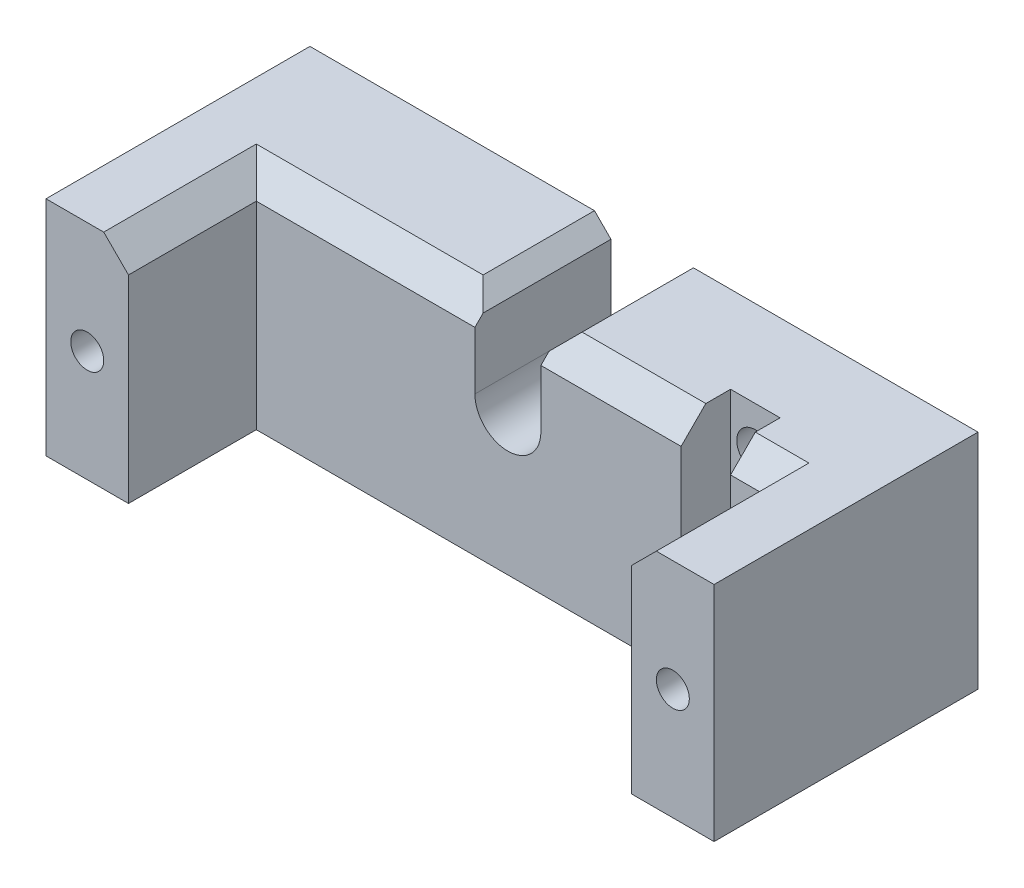
from build123d import *

# Parameters (mm, degrees)
ESQUISSE5_W             = 61
ESQUISSE5_H             = 27
BOSS_EXTRU_2_DEPTH      = 16.5
ENL_V_MAT_EXTRU_2_DEPTH = 16.5
ESQUISSE7_W             = 10
ESQUISSE7_H             = 27
BOSS_EXTRU_3_DEPTH      = 32
ESQUISSE8_R             = 2
ENL_V_MAT_EXTRU_3_DEPTH = 40
ESQUISSE9_R             = 3.75
ENL_V_MAT_EXTRU_4_DEPTH = 4
CHANFREIN1_SIZE         = 2
CHANFREIN2_SIZE         = 3
ESQUISSE10_W            = 6
ESQUISSE10_H            = 6
ENL_V_MAT_EXTRU_5_DEPTH = 36
ESQUISSE11_R            = 2.25
ENL_V_MAT_EXTRU_6_DEPTH = 8
ESQUISSE12_R            = 1.5
ENL_V_MAT_EXTRU_7_DEPTH = 8
CHANFREIN3_SIZE         = 3


with BuildPart() as part:
    # Esquisse5 → Boss.-Extru.2 (new body)
    with BuildSketch(Plane.XY):
        Rectangle(ESQUISSE5_W, ESQUISSE5_H)
    extrude(amount=BOSS_EXTRU_2_DEPTH)

    # Esquisse6 → Enlèv. mat.-Extru.2 (cut)
    with BuildSketch(Plane.XY.offset(16.5)):
        with BuildLine():
            Line((-4, 38.524390244), (4, 38.524390244))
            Line((4, 38.524390244), (4, 3.5))
            ThreePointArc((4, 3.5), (0, -0.5), (-4, 3.5))
            Line((-4, 3.5), (-4, 38.524390244))
        make_face()
    extrude(amount=-ENL_V_MAT_EXTRU_2_DEPTH, mode=Mode.SUBTRACT)

    # Esquisse7 → Boss.-Extru.3 (add)
    with BuildSketch(Plane(origin=(0, 0, 0), x_dir=(-1, 0, 0), z_dir=(0, 0, -1))):
        with Locations((-35.5, 0)):
            Rectangle(ESQUISSE7_W, ESQUISSE7_H)
        with Locations((35.5, 0)):
            Rectangle(ESQUISSE7_W, ESQUISSE7_H)
    extrude(amount=-BOSS_EXTRU_3_DEPTH)

    # Esquisse8 → Enlèv. mat.-Extru.3 (cut)
    with BuildSketch(Plane.XY.offset(32)):
        with Locations((-35.5, 0)):
            Circle(ESQUISSE8_R)
        with Locations((35.5, 0)):
            Circle(ESQUISSE8_R)
    extrude(amount=-ENL_V_MAT_EXTRU_3_DEPTH, mode=Mode.SUBTRACT)

    # Esquisse9 → Enlèv. mat.-Extru.4 (cut)
    with BuildSketch(Plane(origin=(0, 0, 0), x_dir=(-1, 0, 0), z_dir=(0, 0, -1))):
        with Locations((-35.5, 0)):
            Circle(ESQUISSE9_R)
        with Locations((35.5, 0)):
            Circle(ESQUISSE9_R)
    extrude(amount=-ENL_V_MAT_EXTRU_4_DEPTH, mode=Mode.SUBTRACT)

    # Chanfrein1
    chanfrein1_edges = [part.edges().sort_by_distance(p)[0] for p in [
        (-4, 13.5, 8.25),
        (4, 13.5, 8.25),
    ]]
    chamfer(chanfrein1_edges, length=CHANFREIN1_SIZE)

    # Chanfrein2
    chanfrein2_edges = [part.edges().sort_by_distance(p)[0] for p in [
        (30.5, 13.5, 24.25),
        (-30.5, 13.5, 24.25),
    ]]
    chamfer(chanfrein2_edges, length=CHANFREIN2_SIZE)

    # Esquisse10 → Enlèv. mat.-Extru.5 (cut)
    with BuildSketch(Plane(origin=(0, 13.5, 0), x_dir=(1, 0, 0), z_dir=(0, 1, 0))):
        with Locations((24, -13.5)):
            Rectangle(ESQUISSE10_W, ESQUISSE10_H)
    extrude(amount=-ENL_V_MAT_EXTRU_5_DEPTH, mode=Mode.SUBTRACT)

    # Esquisse11 → Enlèv. mat.-Extru.6 (cut)
    with BuildSketch(Plane.XY.offset(10.5)):
        with Locations((24, 8.5)):
            Circle(ESQUISSE11_R)
        with Locations((24, -8.5)):
            Circle(ESQUISSE11_R)
    extrude(amount=-ENL_V_MAT_EXTRU_6_DEPTH, mode=Mode.SUBTRACT)

    # Esquisse12 → Enlèv. mat.-Extru.7 (cut)
    with BuildSketch(Plane.XY.offset(2.5)):
        with Locations((24, 8.5)):
            Circle(ESQUISSE12_R)
        with Locations((24, -8.5)):
            Circle(ESQUISSE12_R)
    extrude(amount=-ENL_V_MAT_EXTRU_7_DEPTH, mode=Mode.SUBTRACT)

    # Chanfrein3
    chanfrein3_edges = [part.edges().sort_by_distance(p)[0] for p in [
        (30.25, 13.5, 16.5),
        (13.5, 13.5, 16.5),
        (-19.75, 13.5, 16.5),
    ]]
    chamfer(chanfrein3_edges, length=CHANFREIN3_SIZE)


solid = part.part
